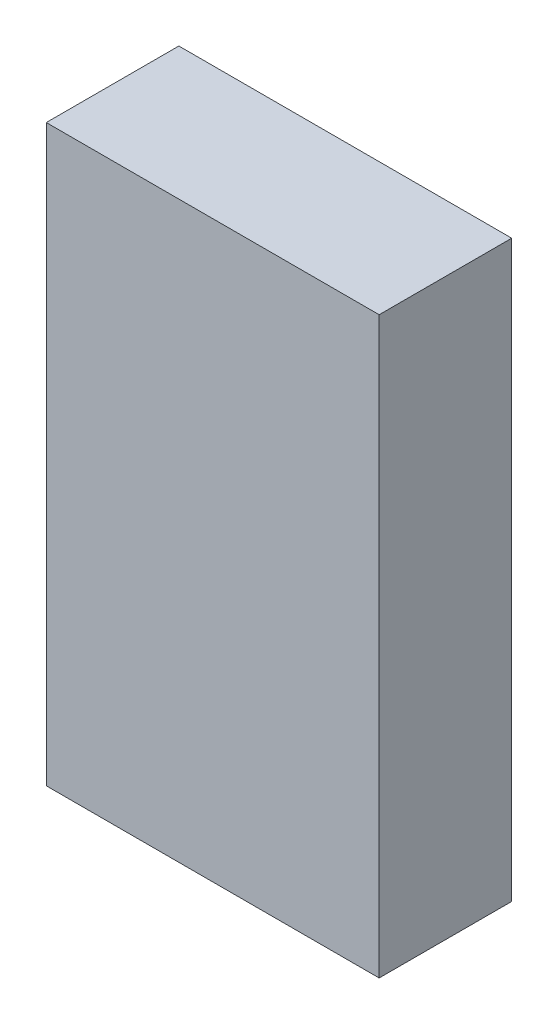
from build123d import *

# Parameters (mm, degrees)
SKETCH_1_W      = 1130
SKETCH_1_H      = 1950
EXTRUDE_1_DEPTH = 450


with BuildPart() as part:
    # Эскиз1 → Бобышка-Вытянуть1 (new body)
    with BuildSketch(Plane.XY):
        Rectangle(SKETCH_1_W, SKETCH_1_H)
    extrude(amount=EXTRUDE_1_DEPTH)


solid = part.part
